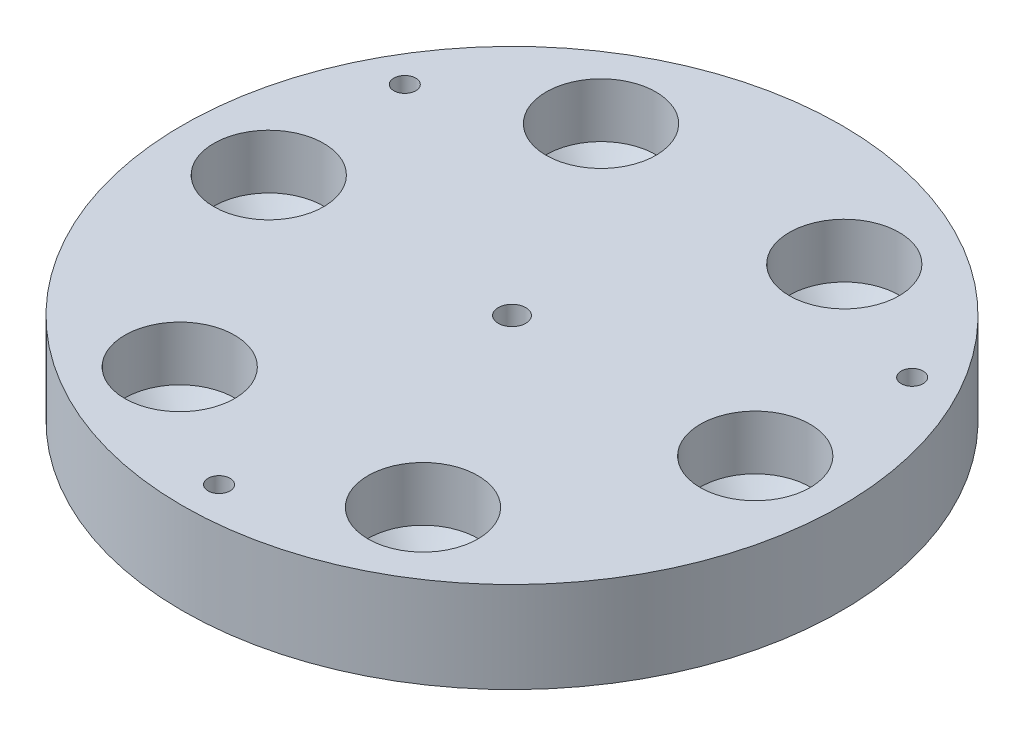
from build123d import *

# Parameters (mm, degrees)
BOSS_EXTRUDE1_DEPTH       = 10.425440853
BOSS_EXTRUDE1_DEPTH_BACK  = 2
SKETCH1_R                 = 45
F_8_0MM_DOWEL_HOLE1_D     = 15
F_8_0MM_DOWEL_HOLE1_DEPTH = 7.425440853
F_8_0MM_DOWEL_HOLE1_TIP   = 7.5
F_3_0_3_DIAMETER_HOLE1_D  = 3
SKETCH2_R                 = 1.875
CUT_EXTRUDE1_DEPTH        = 15


with BuildPart() as part:
    # Sketch1 → Boss-Extrude1 (new, two sides: drawn at the far end of the back side and taken through both)
    with BuildSketch(Plane(origin=(0, 0, 0), x_dir=(1, 0, 0), z_dir=(0, 1, 0)).offset(-BOSS_EXTRUDE1_DEPTH_BACK)):
        with Locations(Location((0, 0, 0), (0, 0, 270))):
            Circle(SKETCH1_R)
    extrude(amount=BOSS_EXTRUDE1_DEPTH + BOSS_EXTRUDE1_DEPTH_BACK)

    # Ø8.0mm Dowel Hole1
    with Locations(Plane(origin=(0, 10.425440853, 0), x_dir=(1, 0, 0), z_dir=(0, 1, 0))):
        with Locations((-16.606971943, 28.764119165), (-16.606971943, -28.764119165), (33.213943886, 0), (16.606971943, 28.764119165), (16.606971943, -28.764119165), (-33.213943886, 0)):
            Hole(F_8_0MM_DOWEL_HOLE1_D / 2, depth=F_8_0MM_DOWEL_HOLE1_DEPTH)
            with Locations((0, 0, -(F_8_0MM_DOWEL_HOLE1_DEPTH + F_8_0MM_DOWEL_HOLE1_TIP / 2))):  # 90° drill point
                Cone(0, F_8_0MM_DOWEL_HOLE1_D / 2, F_8_0MM_DOWEL_HOLE1_TIP, mode=Mode.SUBTRACT)

    # Ø3.0 (3) Diameter Hole1 (through all)
    with Locations(Plane(origin=(0, 10.425440853, 0), x_dir=(1, 0, 0), z_dir=(0, 1, 0))):
        with Locations((-34.641016151, 20), (0, -40), (34.641016151, 20)):
            Hole(F_3_0_3_DIAMETER_HOLE1_D / 2)

    # Sketch2 → Cut-Extrude1 (cut)
    with BuildSketch(Plane(origin=(0, 10.425440853, 0), x_dir=(1, 0, 0), z_dir=(0, 1, 0))):
        with Locations(Location((0, 0, 0), (0, 0, 270))):
            Circle(SKETCH2_R)
    extrude(amount=-CUT_EXTRUDE1_DEPTH, mode=Mode.SUBTRACT)


solid = part.part
